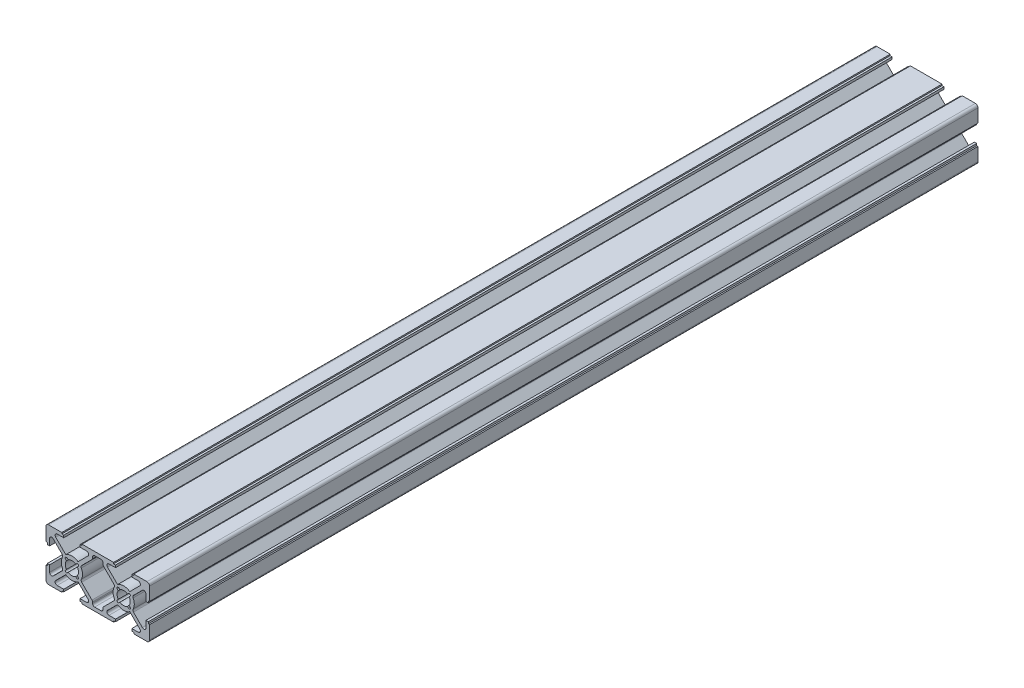
from build123d import *

# Parameters (mm, degrees)
Y_KSEKLIK_EKSTR_ZYON2_DEPTH = 160
RADYUS1_R                   = 0.8


with BuildPart() as part:
    # Çizim3 → Yükseklik-Ekstrüzyon2 (new, symmetric)
    with BuildSketch(Plane.XY):
        with BuildLine():
            Line((1, 0), (6.1, 0))
            Line((6.1, 0), (6.1, 0.5))
            Line((6.1, 0.5), (6.85, 0.5))
            Line((6.85, 0.5), (6.85, 1.4))
            Line((6.85, 1.4), (4.321320344, 1.4))
            ThreePointArc((4.321320344, 1.4), (3.582216718, 1.893853254), (3.755634919, 2.765685425))
            Line((3.755634919, 2.765685425), (7.638403375, 6.648453882))
            ThreePointArc((7.638403375, 6.648453882), (10, 5.9), (12.361596625, 6.648453882))
            Line((12.361596625, 6.648453882), (16.244365081, 2.765685425))
            ThreePointArc((16.244365081, 2.765685425), (16.417783282, 1.893853254), (15.678679656, 1.4))
            Line((15.678679656, 1.4), (13.15, 1.4))
            Line((13.15, 1.4), (13.15, 0.5))
            Line((13.15, 0.5), (13.9, 0.5))
            Line((13.9, 0.5), (13.9, 0))
            Line((13.9, 0), (26.1, 0))
            Line((26.1, 0), (26.1, 0.5))
            Line((26.1, 0.5), (26.85, 0.5))
            Line((26.85, 0.5), (26.85, 1.4))
            Line((26.85, 1.4), (24.321320344, 1.4))
            ThreePointArc((24.321320344, 1.4), (23.582216718, 1.893853254), (23.755634919, 2.765685425))
            Line((23.755634919, 2.765685425), (27.638403375, 6.648453882))
            ThreePointArc((27.638403375, 6.648453882), (30, 5.9), (32.361596625, 6.648453882))
            Line((32.361596625, 6.648453882), (36.244365081, 2.765685425))
            ThreePointArc((36.244365081, 2.765685425), (36.417783282, 1.893853254), (35.678679656, 1.4))
            Line((35.678679656, 1.4), (33.15, 1.4))
            Line((33.15, 1.4), (33.15, 0.5))
            Line((33.15, 0.5), (33.9, 0.5))
            Line((33.9, 0.5), (33.9, 0))
            Line((33.9, 0), (39, 0))
            ThreePointArc((39, 0), (39.707106781, 0.292893219), (40, 1))
            Line((40, 1), (40, 6.1))
            Line((40, 6.1), (39.5, 6.1))
            Line((39.5, 6.1), (39.5, 6.85))
            Line((39.5, 6.85), (38.6, 6.85))
            Line((38.6, 6.85), (38.6, 4.321320344))
            ThreePointArc((38.6, 4.321320344), (38.106146746, 3.582216718), (37.234314575, 3.755634919))
            Line((37.234314575, 3.755634919), (33.351546118, 7.638403375))
            ThreePointArc((33.351546118, 7.638403375), (34.1, 10), (33.351546118, 12.361596625))
            Line((33.351546118, 12.361596625), (37.234314575, 16.244365081))
            ThreePointArc((37.234314575, 16.244365081), (38.106146746, 16.417783282), (38.6, 15.678679656))
            Line((38.6, 15.678679656), (38.6, 13.15))
            Line((38.6, 13.15), (39.5, 13.15))
            Line((39.5, 13.15), (39.5, 13.9))
            Line((39.5, 13.9), (40, 13.9))
            Line((40, 13.9), (40, 19))
            ThreePointArc((40, 19), (39.707106781, 19.707106781), (39, 20))
            Line((39, 20), (33.9, 20))
            Line((33.9, 20), (33.9, 19.5))
            Line((33.9, 19.5), (33.15, 19.5))
            Line((33.15, 19.5), (33.15, 18.6))
            Line((33.15, 18.6), (35.678679656, 18.6))
            ThreePointArc((35.678679656, 18.6), (36.417783282, 18.106146746), (36.244365081, 17.234314575))
            Line((36.244365081, 17.234314575), (32.361596625, 13.351546118))
            ThreePointArc((32.361596625, 13.351546118), (30, 14.1), (27.638403375, 13.351546118))
            Line((27.638403375, 13.351546118), (23.755634919, 17.234314575))
            ThreePointArc((23.755634919, 17.234314575), (23.582216718, 18.106146746), (24.321320344, 18.6))
            Line((24.321320344, 18.6), (26.85, 18.6))
            Line((26.85, 18.6), (26.85, 19.5))
            Line((26.85, 19.5), (26.1, 19.5))
            Line((26.1, 19.5), (26.1, 20))
            Line((26.1, 20), (13.9, 20))
            Line((13.9, 20), (13.9, 19.5))
            Line((13.9, 19.5), (13.15, 19.5))
            Line((13.15, 19.5), (13.15, 18.6))
            Line((13.15, 18.6), (15.678679656, 18.6))
            ThreePointArc((15.678679656, 18.6), (16.417783282, 18.106146746), (16.244365081, 17.234314575))
            Line((16.244365081, 17.234314575), (12.361596625, 13.351546118))
            ThreePointArc((12.361596625, 13.351546118), (10, 14.1), (7.638403375, 13.351546118))
            Line((7.638403375, 13.351546118), (3.755634919, 17.234314575))
            ThreePointArc((3.755634919, 17.234314575), (3.582216718, 18.106146746), (4.321320344, 18.6))
            Line((4.321320344, 18.6), (6.85, 18.6))
            Line((6.85, 18.6), (6.85, 19.5))
            Line((6.85, 19.5), (6.1, 19.5))
            Line((6.1, 19.5), (6.1, 20))
            Line((6.1, 20), (1, 20))
            ThreePointArc((1, 20), (0.292893219, 19.707106781), (0, 19))
            Line((0, 19), (0, 13.9))
            Line((0, 13.9), (0.5, 13.9))
            Line((0.5, 13.9), (0.5, 13.15))
            Line((0.5, 13.15), (1.4, 13.15))
            Line((1.4, 13.15), (1.4, 15.678679656))
            ThreePointArc((1.4, 15.678679656), (1.893853254, 16.417783282), (2.765685425, 16.244365081))
            Line((2.765685425, 16.244365081), (6.648453882, 12.361596625))
            ThreePointArc((6.648453882, 12.361596625), (5.9, 10), (6.648453882, 7.638403375))
            Line((6.648453882, 7.638403375), (2.765685425, 3.755634919))
            ThreePointArc((2.765685425, 3.755634919), (1.893853254, 3.582216718), (1.4, 4.321320344))
            Line((1.4, 4.321320344), (1.4, 6.85))
            Line((1.4, 6.85), (0.5, 6.85))
            Line((0.5, 6.85), (0.5, 6.1))
            Line((0.5, 6.1), (0, 6.1))
            Line((0, 6.1), (0, 1))
            ThreePointArc((0, 1), (0.292893219, 0.292893219), (1, 0))
        make_face()
        with BuildLine():
            Line((21.210320913, 18.6), (18.789679087, 18.6))
            ThreePointArc((18.789679087, 18.6), (18.223993662, 18.365685425), (17.989679087, 17.8))
            Line((17.989679087, 17.8), (17.989679087, 17.331100443))
            ThreePointArc((17.989679087, 17.331100443), (17.928782713, 17.024953697), (17.755364512, 16.765415018))
            Line((17.755364512, 16.765415018), (13.351546118, 12.361596625))
            ThreePointArc((13.351546118, 12.361596625), (14.1, 10), (13.351546118, 7.638403375))
            Line((13.351546118, 7.638403375), (17.755364512, 3.234584982))
            ThreePointArc((17.755364512, 3.234584982), (17.928782713, 2.975046303), (17.989679087, 2.668899557))
            Line((17.989679087, 2.668899557), (17.989679087, 2.2))
            ThreePointArc((17.989679087, 2.2), (18.223993662, 1.634314575), (18.789679087, 1.4))
            Line((18.789679087, 1.4), (21.210320913, 1.4))
            ThreePointArc((21.210320913, 1.4), (21.776006338, 1.634314575), (22.010320913, 2.2))
            Line((22.010320913, 2.2), (22.010320913, 2.668899557))
            ThreePointArc((22.010320913, 2.668899557), (22.071217287, 2.975046303), (22.244635488, 3.234584982))
            Line((22.244635488, 3.234584982), (26.648453882, 7.638403375))
            ThreePointArc((26.648453882, 7.638403375), (25.9, 10), (26.648453882, 12.361596625))
            Line((26.648453882, 12.361596625), (22.244635488, 16.765415018))
            ThreePointArc((22.244635488, 16.765415018), (22.071217287, 17.024953697), (22.010320913, 17.331100443))
            Line((22.010320913, 17.331100443), (22.010320913, 17.8))
            ThreePointArc((22.010320913, 17.8), (21.776006338, 18.365685425), (21.210320913, 18.6))
        make_face(mode=Mode.SUBTRACT)
        with BuildLine():
            Line((8.201142588, 12.443783276), (8.552743846, 12.092182018))
            ThreePointArc((8.552743846, 12.092182018), (10, 12.543968548), (11.447256154, 12.092182018))
            Line((11.447256154, 12.092182018), (11.798857412, 12.443783276))
            ThreePointArc((11.798857412, 12.443783276), (12.443783276, 12.443783276), (12.443783276, 11.798857412))
            Line((12.443783276, 11.798857412), (12.092182018, 11.447256154))
            ThreePointArc((12.092182018, 11.447256154), (12.543968548, 10), (12.092182018, 8.552743846))
            Line((12.092182018, 8.552743846), (12.443783276, 8.201142588))
            ThreePointArc((12.443783276, 8.201142588), (12.443783276, 7.556216724), (11.798857412, 7.556216724))
            Line((11.798857412, 7.556216724), (11.447256154, 7.907817982))
            ThreePointArc((11.447256154, 7.907817982), (10, 7.456031452), (8.552743846, 7.907817982))
            Line((8.552743846, 7.907817982), (8.201142588, 7.556216724))
            ThreePointArc((8.201142588, 7.556216724), (7.556216724, 7.556216724), (7.556216724, 8.201142588))
            Line((7.556216724, 8.201142588), (7.907817982, 8.552743846))
            ThreePointArc((7.907817982, 8.552743846), (7.456031452, 10), (7.907817982, 11.447256154))
            Line((7.907817982, 11.447256154), (7.556216724, 11.798857412))
            ThreePointArc((7.556216724, 11.798857412), (7.556216724, 12.443783276), (8.201142588, 12.443783276))
        make_face(mode=Mode.SUBTRACT)
        with BuildLine():
            Line((27.907817982, 11.447256154), (27.556216724, 11.798857412))
            ThreePointArc((27.556216724, 11.798857412), (27.556216724, 12.443783276), (28.201142588, 12.443783276))
            Line((28.201142588, 12.443783276), (28.552743846, 12.092182018))
            ThreePointArc((28.552743846, 12.092182018), (30, 12.543968548), (31.447256154, 12.092182018))
            Line((31.447256154, 12.092182018), (31.798857412, 12.443783276))
            ThreePointArc((31.798857412, 12.443783276), (32.443783276, 12.443783276), (32.443783276, 11.798857412))
            Line((32.443783276, 11.798857412), (32.092182018, 11.447256154))
            ThreePointArc((32.092182018, 11.447256154), (32.543968548, 10), (32.092182018, 8.552743846))
            Line((32.092182018, 8.552743846), (32.443783276, 8.201142588))
            ThreePointArc((32.443783276, 8.201142588), (32.443783276, 7.556216724), (31.798857412, 7.556216724))
            Line((31.798857412, 7.556216724), (31.447256154, 7.907817982))
            ThreePointArc((31.447256154, 7.907817982), (30, 7.456031452), (28.552743846, 7.907817982))
            Line((28.552743846, 7.907817982), (28.201142588, 7.556216724))
            ThreePointArc((28.201142588, 7.556216724), (27.556216724, 7.556216724), (27.556216724, 8.201142588))
            Line((27.556216724, 8.201142588), (27.907817982, 8.552743846))
            ThreePointArc((27.907817982, 8.552743846), (27.456031452, 10), (27.907817982, 11.447256154))
        make_face(mode=Mode.SUBTRACT)
    extrude(amount=Y_KSEKLIK_EKSTR_ZYON2_DEPTH, both=True)

    # Radyus1
    radyus1_edges = [part.edges().sort_by_distance(p)[0] for p in [
        (6.648453882, 7.638403375, 0),
        (6.648453882, 12.361596625, 0),
        (33.351546118, 12.361596625, 0),
        (33.351546118, 7.638403375, 0),
        (13.351546118, 12.361596625, 0),
        (13.351546118, 7.638403375, 0),
        (26.648453882, 7.638403375, 0),
        (26.648453882, 12.361596625, 0),
    ]]
    fillet(radyus1_edges, radius=RADYUS1_R)


solid = part.part
